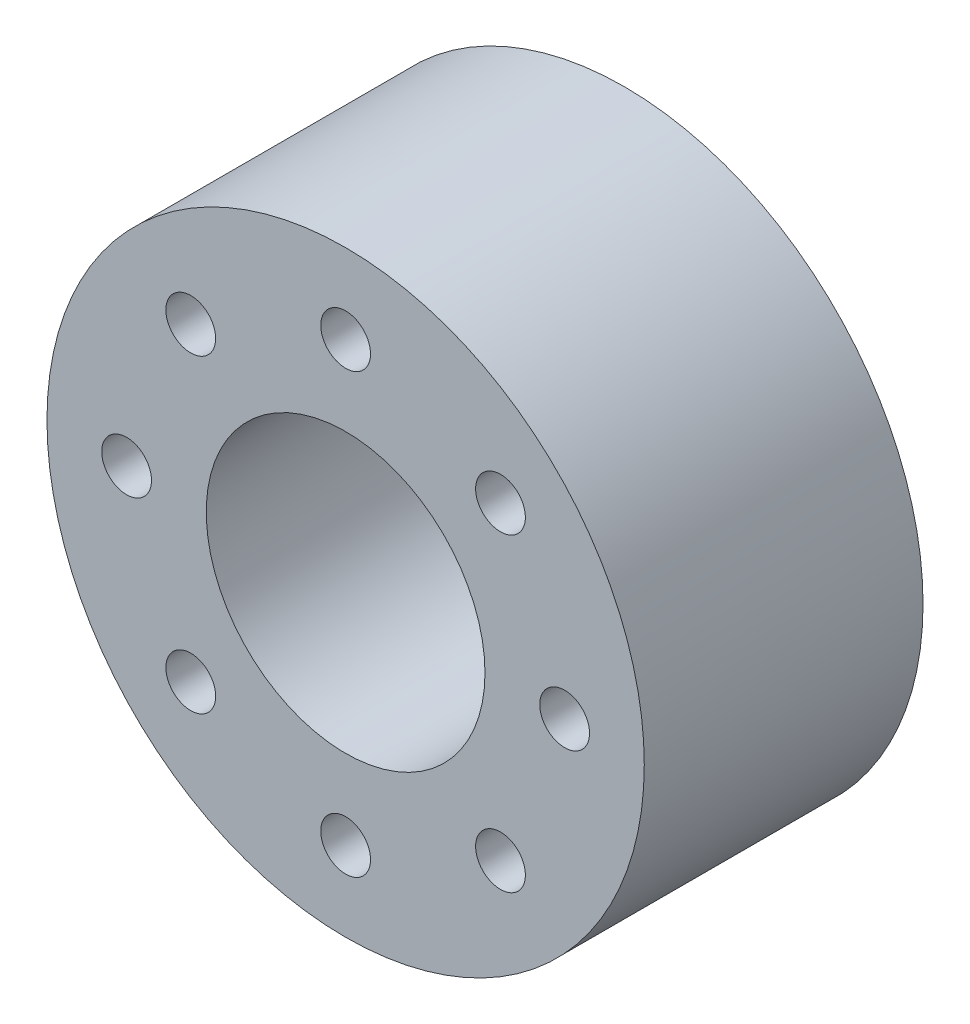
from build123d import *

# Parameters (mm, degrees)
ESBO_O1_R                = 15
ESBO_O1_R_2              = 7
ESBO_O1_R_3              = 1.25
RESSALTO_EXTRUS_O1_DEPTH = 7


with BuildPart() as part:
    # Esboço1 → Ressalto-extrusão1 (new, symmetric)
    with BuildSketch(Plane.XY):
        Circle(ESBO_O1_R)
        Circle(ESBO_O1_R_2, mode=Mode.SUBTRACT)
        with Locations((0, 11)):
            Circle(ESBO_O1_R_3, mode=Mode.SUBTRACT)
        with Locations((7.778174593, 7.778174593)):
            Circle(ESBO_O1_R_3, mode=Mode.SUBTRACT)
        with Locations((11, 0)):
            Circle(ESBO_O1_R_3, mode=Mode.SUBTRACT)
        with Locations((7.778174593, -7.778174593)):
            Circle(ESBO_O1_R_3, mode=Mode.SUBTRACT)
        with Locations((0, -11)):
            Circle(ESBO_O1_R_3, mode=Mode.SUBTRACT)
        with Locations((-7.778174593, -7.778174593)):
            Circle(ESBO_O1_R_3, mode=Mode.SUBTRACT)
        with Locations((-11, 0)):
            Circle(ESBO_O1_R_3, mode=Mode.SUBTRACT)
        with Locations((-7.778174593, 7.778174593)):
            Circle(ESBO_O1_R_3, mode=Mode.SUBTRACT)
    extrude(amount=RESSALTO_EXTRUS_O1_DEPTH, both=True)


solid = part.part
